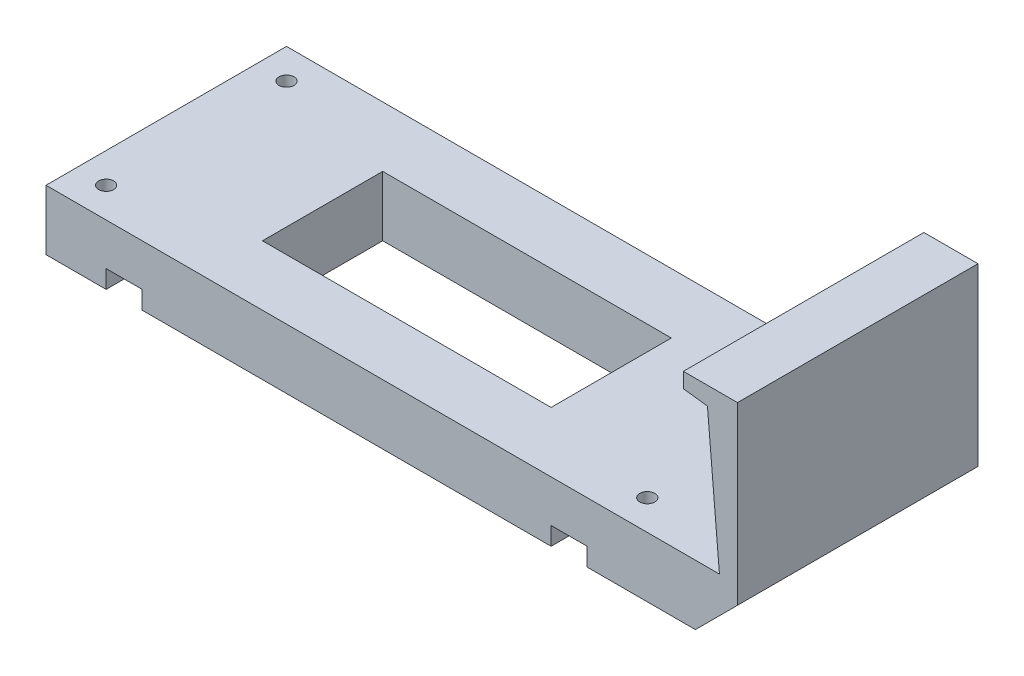
from build123d import *

# Parameters (mm, degrees)
BOSS_EXTRU_1_DEPTH      = 40
ENL_V_MAT_EXTRU_1_REACH = 110.167
ESQUISSE2_W             = 48
ESQUISSE2_H             = 20
ENL_V_MAT_EXTRU_2_REACH = 110.167
ESQUISSE3_R             = 1.25
BOSS_EXTRU_3_DEPTH      = 40


with BuildPart() as part:
    # Esquisse1 → Boss.-Extru.1 (new body)
    with BuildSketch(Plane.XY):
        Polygon((0, 0), (10, 0), (10, 3), (16, 3), (16, 0), (84, 0), (84, 3), (90, 3), (90, 0), (100, 0), (100, 10), (0, 10), align=None)
    extrude(amount=BOSS_EXTRU_1_DEPTH)

    # Esquisse2 → Enlèv. mat.-Extru.1 (cut, up to next)
    with BuildSketch(Plane(origin=(0, 10, 0), x_dir=(1, 0, 0), z_dir=(0, 1, 0)), mode=Mode.PRIVATE) as enl_v_mat_extru_1_sk1:
        with Locations((50, -20)):
            Rectangle(ESQUISSE2_W, ESQUISSE2_H)
    enl_v_mat_extru_1_tool1 = extrude(enl_v_mat_extru_1_sk1.sketch, amount=-ENL_V_MAT_EXTRU_1_REACH, mode=Mode.PRIVATE) & part.part
    add(enl_v_mat_extru_1_tool1.solids().sort_by_distance((50, 10, 20))[0], mode=Mode.SUBTRACT)

    # Esquisse3 → Enlèv. mat.-Extru.2 (cut, up to next)
    with BuildSketch(Plane.XZ, mode=Mode.PRIVATE) as enl_v_mat_extru_2_sk1:
        with Locations(Location((5, 35, 0), (0, 0, 270))):
            Circle(ESQUISSE3_R)
    enl_v_mat_extru_2_tool1 = extrude(enl_v_mat_extru_2_sk1.sketch, amount=-ENL_V_MAT_EXTRU_2_REACH, mode=Mode.PRIVATE) & part.part
    # Esquisse3 → Enlèv. mat.-Extru.2 (cut, up to next)
    with BuildSketch(Plane.XZ, mode=Mode.PRIVATE) as enl_v_mat_extru_2_sk2:
        with Locations(Location((5, 5, 0), (0, 0, 270))):
            Circle(ESQUISSE3_R)
    enl_v_mat_extru_2_tool2 = extrude(enl_v_mat_extru_2_sk2.sketch, amount=-ENL_V_MAT_EXTRU_2_REACH, mode=Mode.PRIVATE) & part.part
    # Esquisse3 → Enlèv. mat.-Extru.2 (cut, up to next)
    with BuildSketch(Plane.XZ, mode=Mode.PRIVATE) as enl_v_mat_extru_2_sk3:
        with Locations(Location((95, 35, 0), (0, 0, 270))):
            Circle(ESQUISSE3_R)
    enl_v_mat_extru_2_tool3 = extrude(enl_v_mat_extru_2_sk3.sketch, amount=-ENL_V_MAT_EXTRU_2_REACH, mode=Mode.PRIVATE) & part.part
    # Esquisse3 → Enlèv. mat.-Extru.2 (cut, up to next)
    with BuildSketch(Plane.XZ, mode=Mode.PRIVATE) as enl_v_mat_extru_2_sk4:
        with Locations(Location((95, 5, 0), (0, 0, 270))):
            Circle(ESQUISSE3_R)
    enl_v_mat_extru_2_tool4 = extrude(enl_v_mat_extru_2_sk4.sketch, amount=-ENL_V_MAT_EXTRU_2_REACH, mode=Mode.PRIVATE) & part.part
    add(enl_v_mat_extru_2_tool1.solids().sort_by_distance((5, 0, 35))[0], mode=Mode.SUBTRACT)
    add(enl_v_mat_extru_2_tool2.solids().sort_by_distance((5, 0, 5))[0], mode=Mode.SUBTRACT)
    add(enl_v_mat_extru_2_tool3.solids().sort_by_distance((95, 0, 35))[0], mode=Mode.SUBTRACT)
    add(enl_v_mat_extru_2_tool4.solids().sort_by_distance((95, 0, 5))[0], mode=Mode.SUBTRACT)

    # Esquisse4 → Boss.-Extru.3 (add)
    with BuildSketch(Plane(origin=(0, 0, 0), x_dir=(-1, 0, 0), z_dir=(0, 0, -1))):
        Polygon((-100, 10), (-112, 10), (-110, 33.2), (-106, 33.7), (-106, 36.2), (-115, 36.2), (-115, 7), (-108, 0), (-100, 0), align=None)
    extrude(amount=-BOSS_EXTRU_3_DEPTH)


solid = part.part
